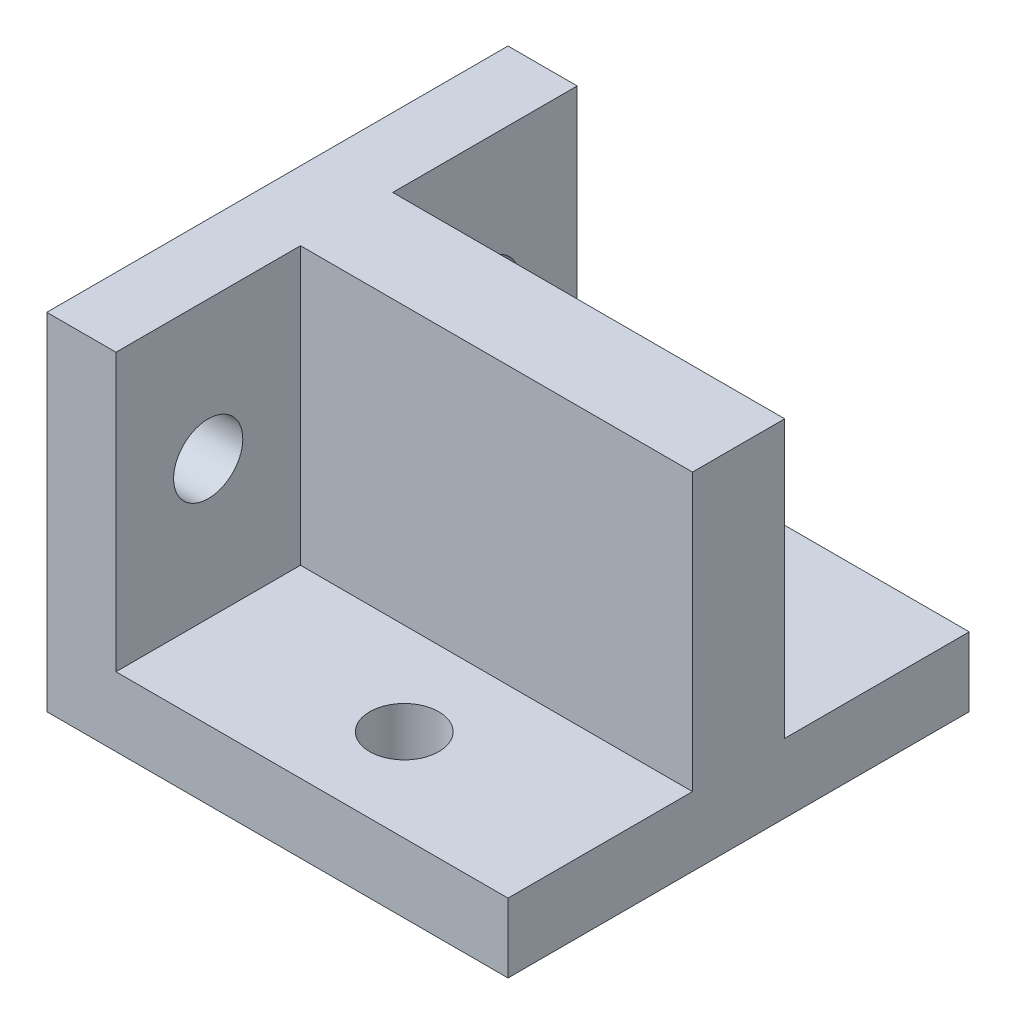
from build123d import *

# Parameters (mm, degrees)
EXTRUDE_1_DEPTH     = 20
SKETCH_2_R          = 1.5
CUT_EXTRUDE_1_DEPTH = 29.861739379
SKETCH_3_R          = 1.5
CUT_EXTRUDE_2_DEPTH = 29.861739379
SKETCH_4_W          = 4
SKETCH_4_H          = 12
EXTRUDE_2_DEPTH     = 17


with BuildPart() as part:
    # 草图1 → 凸台-拉伸1 (new body)
    with BuildSketch(Plane.XY):
        Polygon((0, 0), (0, 12), (-3, 12), (-3, -3), (17, -3), (17, 0), align=None)
    extrude(amount=EXTRUDE_1_DEPTH)

    # 草图2 → 切除-拉伸1 (cut, through all)
    with BuildSketch(Plane(origin=(0, 0, 0), x_dir=(0, 0, -1), z_dir=(1, 0, 0))):
        with Locations(Location((-16, 6, 0), (0, 0, 90))):
            Circle(SKETCH_2_R)
        with Locations(Location((-4, 6, 0), (0, 0, 270))):
            Circle(SKETCH_2_R)
    extrude(amount=-CUT_EXTRUDE_1_DEPTH, mode=Mode.SUBTRACT)

    # 草图3 → 切除-拉伸2 (cut, through all)
    with BuildSketch(Plane(origin=(0, 0, 0), x_dir=(1, 0, 0), z_dir=(0, 1, 0))):
        with Locations(Location((8.5, -16, 0), (0, 0, 180))):
            Circle(SKETCH_3_R)
        with Locations((8.5, -4)):
            Circle(SKETCH_3_R)
    extrude(amount=-CUT_EXTRUDE_2_DEPTH, mode=Mode.SUBTRACT)

    # 草图4 → 凸台-拉伸2 (add)
    with BuildSketch(Plane(origin=(0, 0, 0), x_dir=(0, 0, -1), z_dir=(1, 0, 0))):
        with Locations((-10, 6)):
            Rectangle(SKETCH_4_W, SKETCH_4_H)
    extrude(amount=EXTRUDE_2_DEPTH)


solid = part.part
